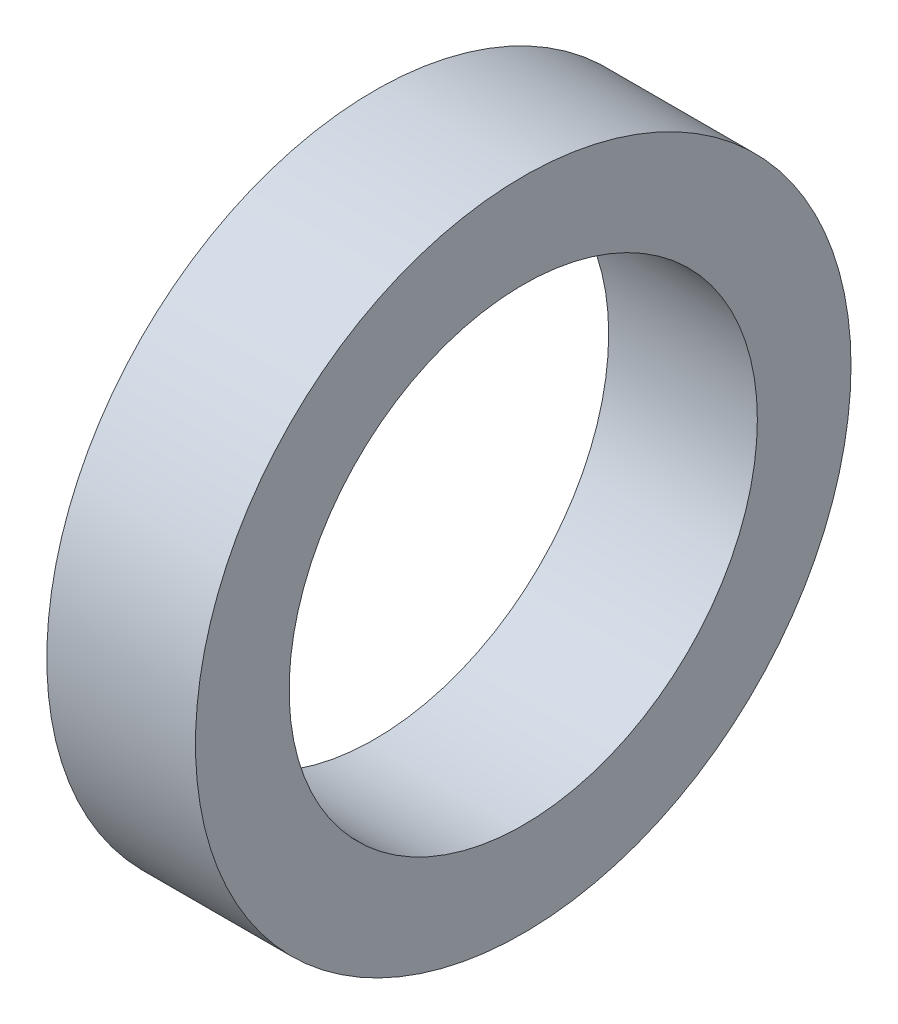
from build123d import *

# Parameters (mm, degrees)
SKETCH1_R           = 3.5
SKETCH1_R_2         = 2.5
BOSS_EXTRUDE1_DEPTH = 1.5875


with BuildPart() as part:
    # Sketch1 → Boss-Extrude1 (new body)
    with BuildSketch(Plane(origin=(0, 0, 0), x_dir=(0, 0, -1), z_dir=(1, 0, 0))):
        Circle(SKETCH1_R)
        Circle(SKETCH1_R_2, mode=Mode.SUBTRACT)
    extrude(amount=BOSS_EXTRUDE1_DEPTH)


solid = part.part
